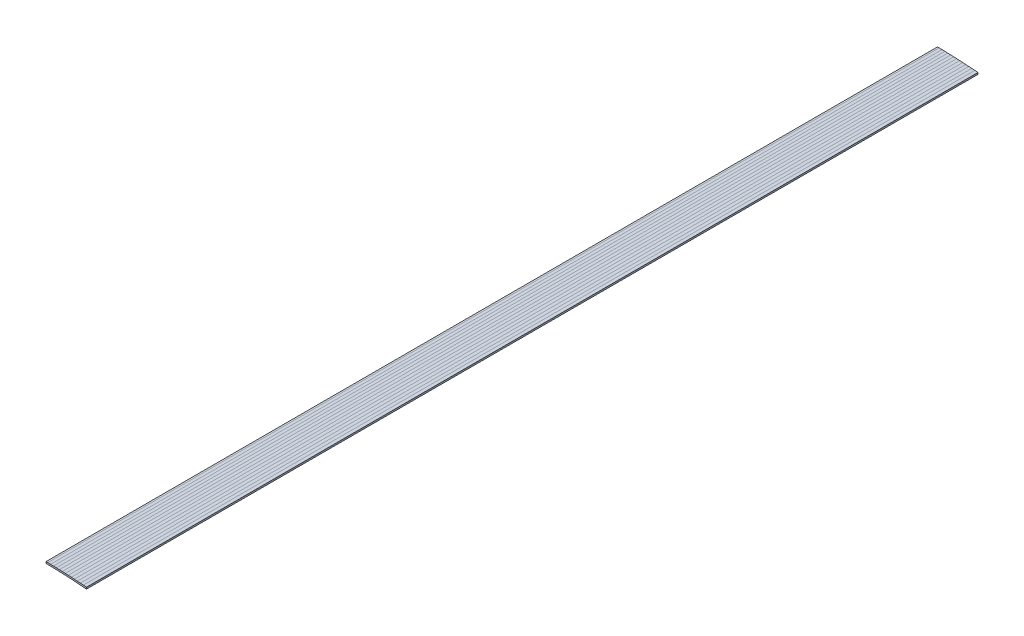
from build123d import *

# Parameters (mm, degrees)
DEFINED_MATERIAL_SECTION_L220_DEPTH = 220


with BuildPart() as part:
    # Sketch1 → Defined_Material_Section_L220 (new body)
    with BuildSketch(Plane.XY):
        Polygon((12.420897198, 2.024592435), (13.123994434, 2.013881565), (13.836251383, 1.998044999), (14.556561449, 1.977283418), (15.28380601, 1.951813275), (16.016856081, 1.921864485), (16.754574, 1.887678119), (17.495815146, 1.849504144), (18.239429685, 1.807599235), (18.984264321, 1.762224717), (19.729164078, 1.713644652), (20.472974075, 1.662124111), (21.214541315, 1.60792765), (21.952716474, 1.55131799), (22, 1.547530673), (22, 1.146249586), (21.921455096, 1.152540877), (21.184670536, 1.209043894), (20.444576084, 1.263132719), (19.702328203, 1.314545058), (18.959087234, 1.363016942), (18.216015579, 1.408284062), (17.474275891, 1.450083317), (16.735029283, 1.488154573), (15.999433548, 1.522242595), (15.268641415, 1.552099138), (14.543798827, 1.577485157), (13.826043272, 1.598173108), (13.116502158, 1.61394929), (12.41629125, 1.62461619), (12, 1.627862257), (12, 2.027874417), align=None)
    extrude(amount=DEFINED_MATERIAL_SECTION_L220_DEPTH)


solid = part.part
